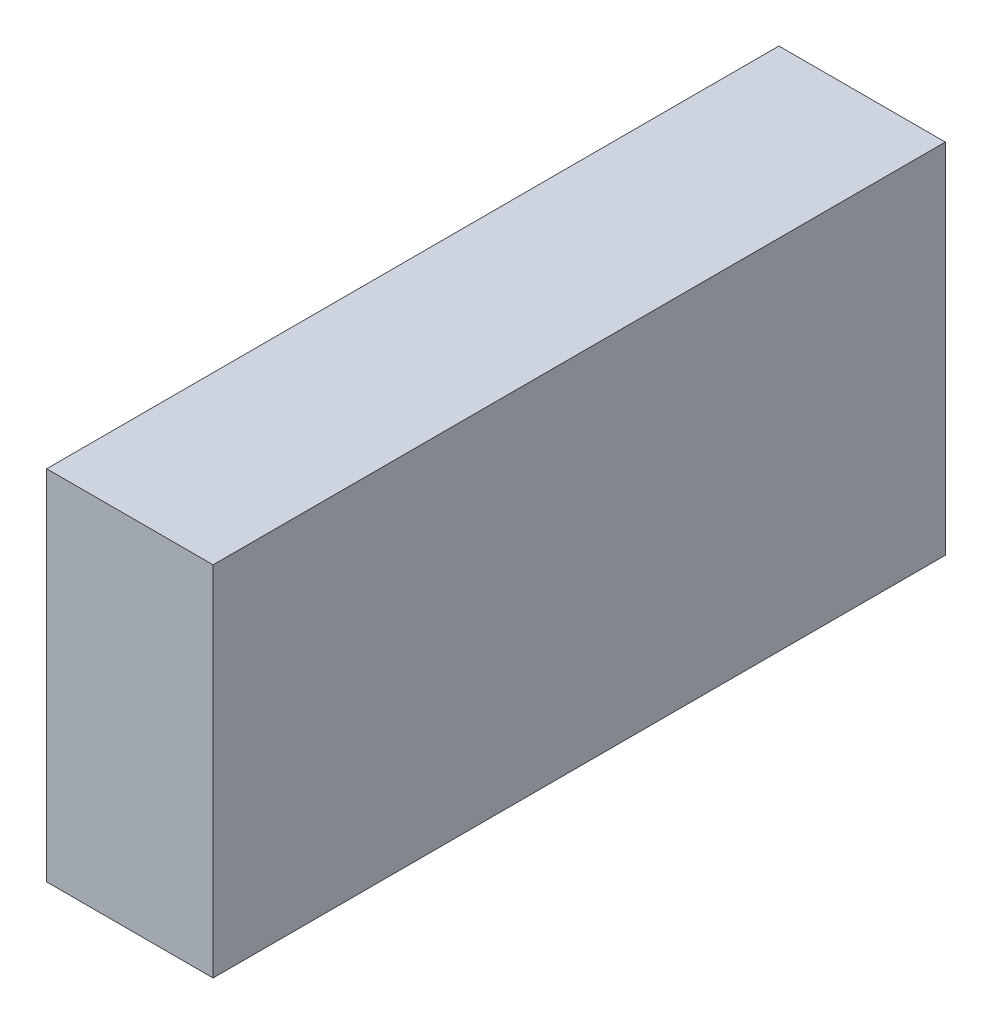
from build123d import *

# Parameters (mm, degrees)
SKETCH1_W           = 100
SKETCH1_H           = 440
BOSS_EXTRUDE1_DEPTH = 215


with BuildPart() as part:
    # Sketch1 → Boss-Extrude1 (new body)
    with BuildSketch(Plane(origin=(0, 0, 0), x_dir=(1, 0, 0), z_dir=(0, 1, 0))):
        Rectangle(SKETCH1_W, SKETCH1_H)
    extrude(amount=BOSS_EXTRUDE1_DEPTH)


solid = part.part
